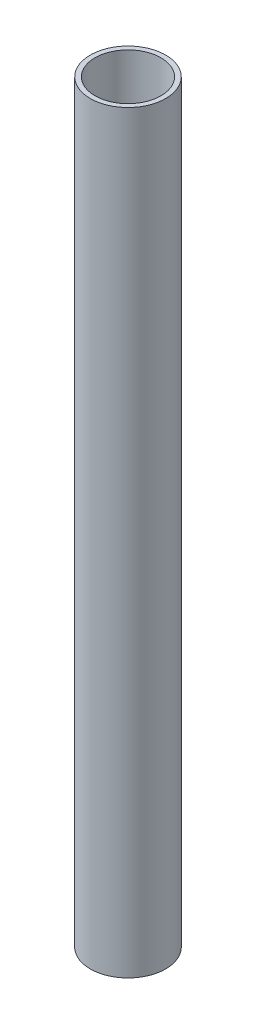
from build123d import *

# Parameters (mm, degrees)
SKETCH_1_R      = 8
SKETCH_1_R_2    = 7
EXTRUDE_1_DEPTH = 160


with BuildPart() as part:
    # 草图1 → 凸台-拉伸1 (new body)
    with BuildSketch(Plane(origin=(0, 0, 0), x_dir=(1, 0, 0), z_dir=(0, 1, 0))):
        with Locations(Location((0, 0, 0), (0, 0, 270))):
            Circle(SKETCH_1_R)
        with Locations(Location((0, 0, 0), (0, 0, 270))):
            Circle(SKETCH_1_R_2, mode=Mode.SUBTRACT)
    extrude(amount=EXTRUDE_1_DEPTH)


solid = part.part
